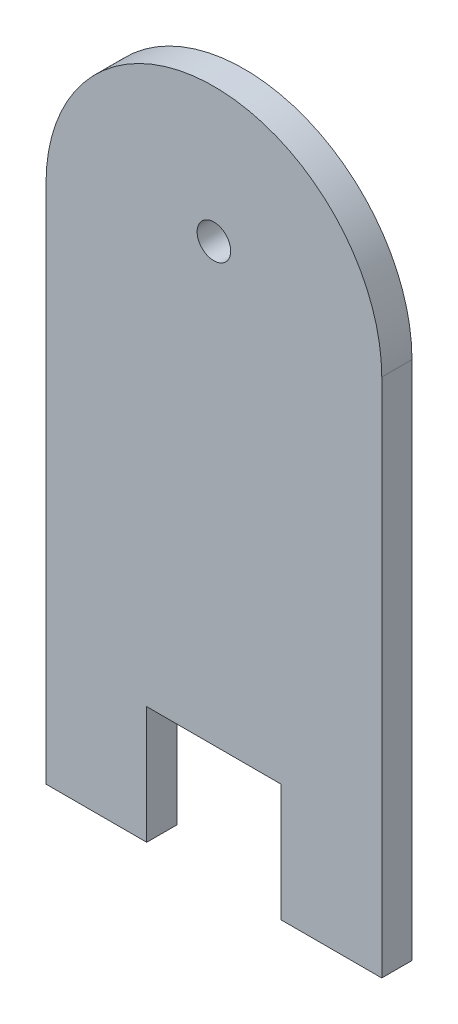
from build123d import *

# Parameters (mm, degrees)
SKETCH1_W           = 15
SKETCH1_H           = 10
SKETCH1_H_2         = 7.5
BOSS_EXTRUDE1_DEPTH = 4.5
SKETCH2_R           = 2.5
CUT_EXTRUDE1_DEPTH  = 10


with BuildPart() as part:
    # Sketch1 → Boss-Extrude1 (new body)
    with BuildSketch(Plane.XY):
        Polygon((-25, -55), (-10, -55), (10, -55), (25, -55), (25, 5), (-25, 5), align=None)
        with Locations((17.5, -60)):
            Rectangle(SKETCH1_W, SKETCH1_H)
        with Locations((-17.5, -60)):
            Rectangle(SKETCH1_W, SKETCH1_H)
        with BuildLine():
            Line((-25, 5), (25, 5))
            ThreePointArc((25, 5), (0, 30), (-25, 5))
        make_face()
        with Locations((-17.5, -68.75)):
            Rectangle(SKETCH1_W, SKETCH1_H_2)
        with Locations((17.5, -68.75)):
            Rectangle(SKETCH1_W, SKETCH1_H_2)
    extrude(amount=BOSS_EXTRUDE1_DEPTH)

    # Sketch2 → Cut-Extrude1 (cut)
    with BuildSketch(Plane.XY.offset(4.5)):
        with Locations((0, 10)):
            Circle(SKETCH2_R)
    extrude(amount=-CUT_EXTRUDE1_DEPTH, mode=Mode.SUBTRACT)


solid = part.part
